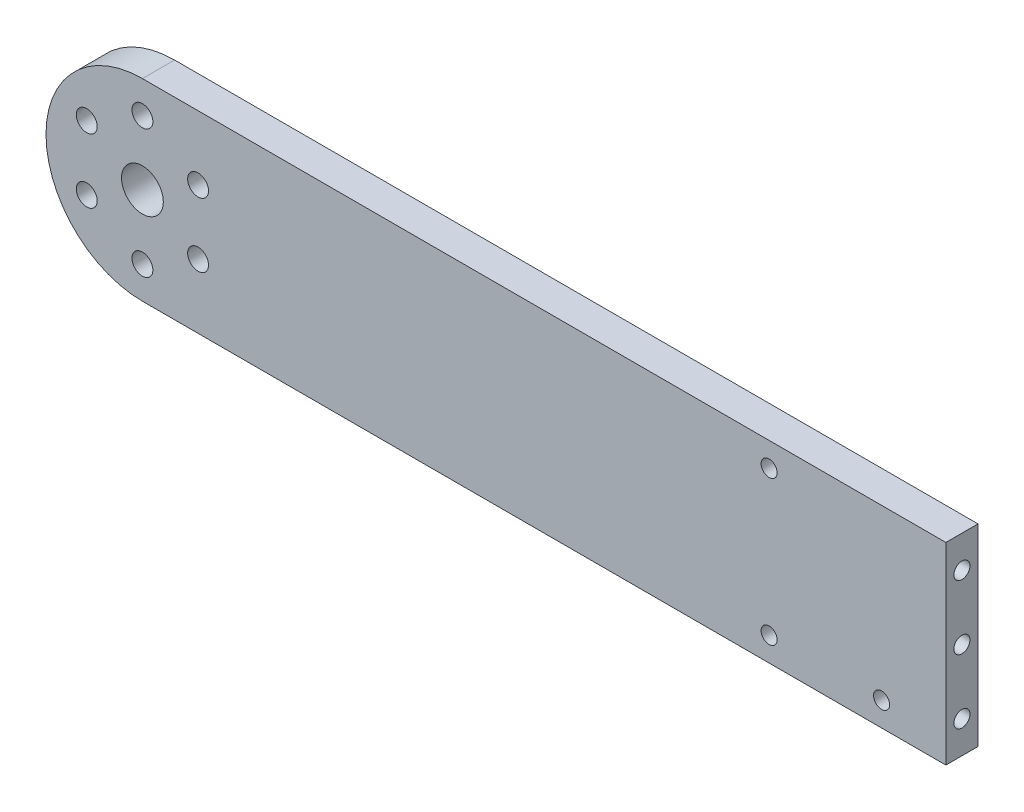
from build123d import *

# Parameters (mm, degrees)
SALIENTE_EXTRUIR1_DEPTH = 10
CROQUIS6_R              = 17.5
CORTAR_EXTRUIR5_DEPTH   = 203.484567313
CROQUIS7_R              = 2.5
CORTAR_EXTRUIR6_DEPTH   = 10
SKETCH1_W               = 10
SKETCH1_H               = 60
BOSS_EXTRUDE1_DEPTH     = 50
SKETCH2_R               = 2.5
CUT_EXTRUDE1_DEPTH      = 10
SKETCH5_R               = 2.5
CUT_EXTRUDE2_DEPTH      = 252.992063367
SKETCH6_R               = 17.5
SKETCH6_R_2             = 6.5
BOSS_EXTRUDE2_DEPTH     = 10
SKETCH7_R               = 3.25
CUT_EXTRUDE3_DEPTH      = 10
CIRPATTERN1_COUNT       = 6


with BuildPart() as part:
    # Croquis1 → Saliente-Extruir1 (new body)
    with BuildSketch(Plane.XY):
        with BuildLine():
            Line((200, 30), (200, -30))
            Line((200, -30), (0, -30))
            ThreePointArc((0, -30), (-30, 0), (0, 30))
            Line((0, 30), (200, 30))
        make_face()
    extrude(amount=SALIENTE_EXTRUIR1_DEPTH)

    # Croquis6 → Cortar-Extruir5 (cut, through all)
    with BuildSketch(Plane.XY.offset(10)):
        Circle(CROQUIS6_R)
    extrude(amount=-CORTAR_EXTRUIR5_DEPTH, mode=Mode.SUBTRACT)

    # Croquis7 → Cortar-Extruir6 (cut)
    with BuildSketch(Plane.XY.offset(10)):
        with Locations((195, 22.5)):
            Circle(CROQUIS7_R)
        with Locations((195, -22.5)):
            Circle(CROQUIS7_R)
    extrude(amount=-CORTAR_EXTRUIR6_DEPTH, mode=Mode.SUBTRACT)

    # Sketch1 → Boss-Extrude1 (add)
    with BuildSketch(Plane(origin=(200, 0, 0), x_dir=(0, 0, -1), z_dir=(1, 0, 0))):
        with Locations((-5, 0)):
            Rectangle(SKETCH1_W, SKETCH1_H)
    extrude(amount=BOSS_EXTRUDE1_DEPTH)

    # Sketch2 → Cut-Extrude1 (cut)
    with BuildSketch(Plane(origin=(250, 0, 0), x_dir=(0, 0, -1), z_dir=(1, 0, 0))):
        with Locations((-5, 0)):
            Circle(SKETCH2_R)
        with Locations((-5, 20)):
            Circle(SKETCH2_R)
        with Locations((-5, -20)):
            Circle(SKETCH2_R)
    extrude(amount=-CUT_EXTRUDE1_DEPTH, mode=Mode.SUBTRACT)

    # Sketch5 → Cut-Extrude2 (cut, through all)
    with BuildSketch(Plane.XY.offset(10)):
        with Locations((230, -22.5)):
            Circle(SKETCH5_R)
    extrude(amount=-CUT_EXTRUDE2_DEPTH, mode=Mode.SUBTRACT)

    # Sketch6 → Boss-Extrude2 (add)
    with BuildSketch(Plane.XY.offset(10)):
        Circle(SKETCH6_R)
        Circle(SKETCH6_R_2, mode=Mode.SUBTRACT)
    extrude(amount=-BOSS_EXTRUDE2_DEPTH)

    # Sketch7 → Cut-Extrude3 (cut)
    with BuildSketch(Plane.XY.offset(10)):
        with Locations((0, 20)):
            Circle(SKETCH7_R)
    cut_extrude3 = extrude(amount=-CUT_EXTRUDE3_DEPTH, mode=Mode.SUBTRACT)

    # CirPattern1: Cut-Extrude3 ×6 about axis
    cirpattern1_axis = Axis((0, 0, 0), (0, 0, 1))
    for i in range(1, CIRPATTERN1_COUNT):
        add(cut_extrude3.rotate(cirpattern1_axis, i * 360 / CIRPATTERN1_COUNT), mode=Mode.SUBTRACT)


solid = part.part
